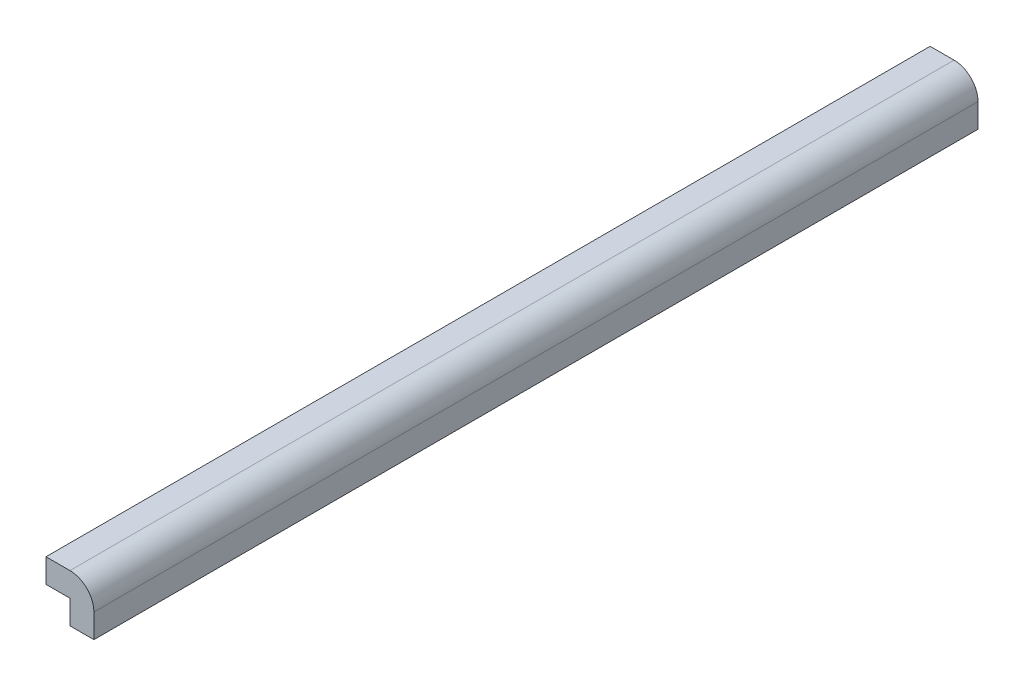
from build123d import *

# Parameters (mm, degrees)
BOSS_EXTRUDE1_DEPTH = 480


with BuildPart() as part:
    # Sketch1 → Boss-Extrude1 (new body)
    with BuildSketch(Plane.XY):
        with BuildLine():
            Line((0, 0), (-13, 0))
            Line((-13, 0), (-13, 13))
            Line((-13, 13), (0, 13))
            ThreePointArc((0, 13), (9.192388155, 9.192388155), (13, 0))
            Line((13, 0), (13, -13))
            Line((13, -13), (0, -13))
            Line((0, -13), (0, 0))
        make_face()
    extrude(amount=BOSS_EXTRUDE1_DEPTH)


solid = part.part
